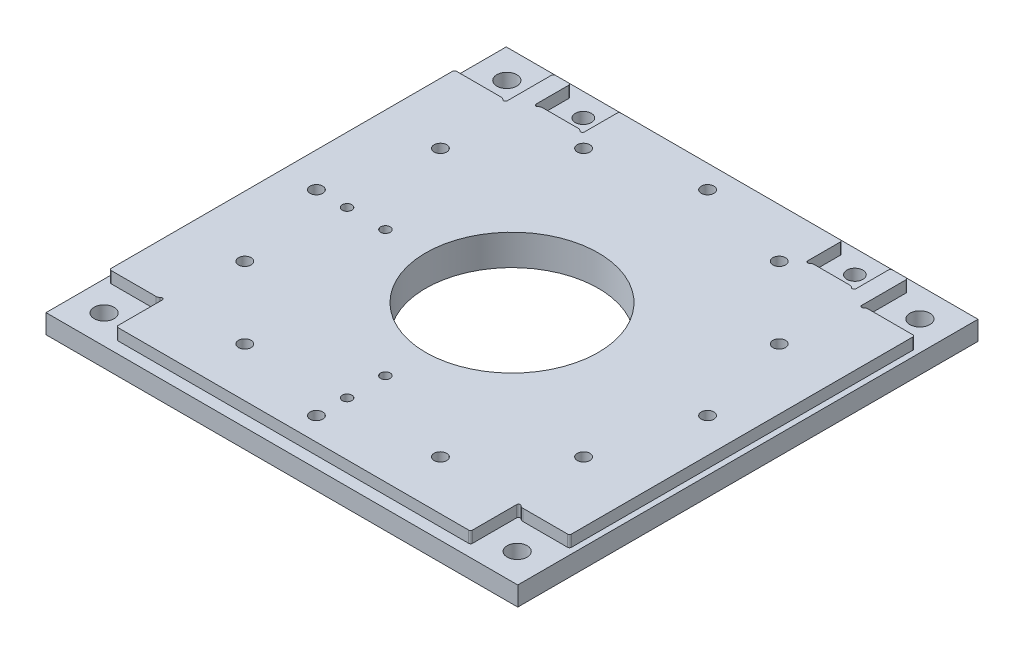
from build123d import *

# Parameters (mm, degrees)
SKETCH_1_W          = 120
SKETCH_1_H          = 120
EXTRUDE_1_DEPTH     = 3
SKETCH_3_W          = 123
SKETCH_3_H          = 120
EXTRUDE_2_DEPTH     = 5
SKETCH_2_R          = 1.65
CUT_EXTRUDE_1_DEPTH = 87.291656607
SKETCH_5_W          = 15.3
SKETCH_5_H          = 15
SKETCH_5_W_2        = 12.6
SKETCH_5_H_2        = 12
CUT_EXTRUDE_2_DEPTH = 3
SKETCH_6_R          = 2.6
SKETCH_6_R_2        = 2.1
CUT_EXTRUDE_3_DEPTH = 87.291656607
SKETCH_7_R          = 5.5
SKETCH_7_R_2        = 4.6
CUT_EXTRUDE_4_DEPTH = 1
SKETCH_8_R          = 22.5
CUT_EXTRUDE_5_DEPTH = 87.291656607
SKETCH_9_R          = 1.25
CUT_EXTRUDE_6_DEPTH = 87.291656607
SKETCH_11_W         = 92.4
SKETCH_11_H         = 3
CUT_EXTRUDE_7_DEPTH = 3
FILLET_1_R          = 0.5
SKETCH_12_R         = 0.5
CUT_EXTRUDE_8_DEPTH = 3
FILLET_2_R          = 1


with BuildPart() as part:
    # 草图1 → 凸台-拉伸1 (new body)
    with BuildSketch(Plane(origin=(0, 0, 0), x_dir=(1, 0, 0), z_dir=(0, 1, 0))):
        Rectangle(SKETCH_1_W, SKETCH_1_H)
    extrude(amount=EXTRUDE_1_DEPTH)

    # 草图3 → 凸台-拉伸2 (add)
    with BuildSketch(Plane.XZ):
        Rectangle(SKETCH_3_W, SKETCH_3_H)
    extrude(amount=EXTRUDE_2_DEPTH)

    # 草图2 → 切除-拉伸1 (cut, through all)
    with BuildSketch(Plane(origin=(0, 3, 0), x_dir=(1, 0, 0), z_dir=(0, 1, 0))):
        with Locations(Location((-51, 0, 0), (0, 0, 270))):
            Circle(SKETCH_2_R)
        with Locations(Location((-44.167295593, -25.5, 0), (0, 0, 270))):
            Circle(SKETCH_2_R)
        with Locations(Location((-25.5, -44.167295593, 0), (0, 0, 270))):
            Circle(SKETCH_2_R)
        with Locations(Location((0, -51, 0), (0, 0, 270))):
            Circle(SKETCH_2_R)
        with Locations(Location((25.5, -44.167295593, 0), (0, 0, 270))):
            Circle(SKETCH_2_R)
        with Locations(Location((44.167295593, -25.5, 0), (0, 0, 270))):
            Circle(SKETCH_2_R)
        with Locations(Location((-25.5, 44.167295593, 0), (0, 0, 270))):
            Circle(SKETCH_2_R)
        with Locations(Location((-44.167295593, 25.5, 0), (0, 0, 270))):
            Circle(SKETCH_2_R)
        with Locations(Location((0, 51, 0), (0, 0, 270))):
            Circle(SKETCH_2_R)
        with Locations(Location((25.5, 44.167295593, 0), (0, 0, 270))):
            Circle(SKETCH_2_R)
        with Locations(Location((44.167295593, 25.5, 0), (0, 0, 270))):
            Circle(SKETCH_2_R)
        with Locations(Location((51, 0, 0), (0, 0, 270))):
            Circle(SKETCH_2_R)
    extrude(amount=-CUT_EXTRUDE_1_DEPTH, mode=Mode.SUBTRACT)

    # 草图5 → 切除-拉伸2 (cut)
    with BuildSketch(Plane(origin=(0, 3, 0), x_dir=(1, 0, 0), z_dir=(0, 1, 0))):
        with Locations((-53.85, 52.5)):
            Rectangle(SKETCH_5_W, SKETCH_5_H)
        with Locations((53.85, 52.5)):
            Rectangle(SKETCH_5_W, SKETCH_5_H)
        with Locations((-35.4, 54)):
            Rectangle(SKETCH_5_W_2, SKETCH_5_H_2)
        with Locations((35.4, 54)):
            Rectangle(SKETCH_5_W_2, SKETCH_5_H_2)
        with Locations((-53.85, -52.5)):
            Rectangle(SKETCH_5_W, SKETCH_5_H)
        with Locations((53.85, -52.5)):
            Rectangle(SKETCH_5_W, SKETCH_5_H)
    extrude(amount=-CUT_EXTRUDE_2_DEPTH, mode=Mode.SUBTRACT)

    # 草图6 → 切除-拉伸3 (cut, through all)
    with BuildSketch(Plane(origin=(0, 3, 0), x_dir=(1, 0, 0), z_dir=(0, 1, 0))):
        with Locations(Location((-53.85, -52.5, 0), (0, 0, 270))):
            Circle(SKETCH_6_R)
        with Locations(Location((53.85, -52.5, 0), (0, 0, 270))):
            Circle(SKETCH_6_R)
        with Locations(Location((-53.85, 52.5, 0), (0, 0, 270))):
            Circle(SKETCH_6_R)
        with Locations(Location((-35.4, 54, 0), (0, 0, 270))):
            Circle(SKETCH_6_R_2)
        with Locations(Location((53.85, 52.5, 0), (0, 0, 270))):
            Circle(SKETCH_6_R)
        with Locations(Location((35.4, 54, 0), (0, 0, 270))):
            Circle(SKETCH_6_R_2)
    extrude(amount=-CUT_EXTRUDE_3_DEPTH, mode=Mode.SUBTRACT)

    # 草图7 → 切除-拉伸4 (cut)
    with BuildSketch(Plane.XZ.offset(5)):
        with Locations(Location((-53.85, 52.5, 0), (0, 0, 270))):
            Circle(SKETCH_7_R)
        with Locations(Location((-53.85, -52.5, 0), (0, 0, 270))):
            Circle(SKETCH_7_R)
        with Locations(Location((-35.4, -54, 0), (0, 0, 270))):
            Circle(SKETCH_7_R_2)
        with Locations(Location((53.85, 52.5, 0), (0, 0, 270))):
            Circle(SKETCH_7_R)
        with Locations(Location((53.85, -52.5, 0), (0, 0, 270))):
            Circle(SKETCH_7_R)
        with Locations(Location((35.4, -54, 0), (0, 0, 270))):
            Circle(SKETCH_7_R_2)
    extrude(amount=-CUT_EXTRUDE_4_DEPTH, mode=Mode.SUBTRACT)

    # 草图8 → 切除-拉伸5 (cut, through all)
    with BuildSketch(Plane(origin=(0, 3, 0), x_dir=(1, 0, 0), z_dir=(0, 1, 0))):
        with Locations(Location((0, 0, 0), (0, 0, 270))):
            Circle(SKETCH_8_R)
    extrude(amount=-CUT_EXTRUDE_5_DEPTH, mode=Mode.SUBTRACT)

    # 草图9 → 切除-拉伸6 (cut, through all)
    with BuildSketch(Plane(origin=(0, 3, 0), x_dir=(1, 0, 0), z_dir=(0, 1, 0))):
        with Locations(Location((0, -43, 0), (0, 0, 270))):
            Circle(SKETCH_9_R)
        with Locations(Location((0, -33, 0), (0, 0, 270))):
            Circle(SKETCH_9_R)
        with Locations(Location((-43, 0, 0), (0, 0, 270))):
            Circle(SKETCH_9_R)
        with Locations(Location((-33, 0, 0), (0, 0, 270))):
            Circle(SKETCH_9_R)
    extrude(amount=-CUT_EXTRUDE_6_DEPTH, mode=Mode.SUBTRACT)

    # 草图11 → 切除-拉伸7 (cut)
    with BuildSketch(Plane(origin=(0, 3, 0), x_dir=(1, 0, 0), z_dir=(0, 1, 0))):
        with Locations((0, -58.5)):
            Rectangle(SKETCH_11_W, SKETCH_11_H)
        with Locations((0, 58.5)):
            Rectangle(SKETCH_11_W, SKETCH_11_H)
    extrude(amount=-CUT_EXTRUDE_7_DEPTH, mode=Mode.SUBTRACT)

    # 圆角1
    fillet_1_edges = [part.edges().sort_by_distance(p)[0] for p in [
        (-60, 1.5, 45),
        (60, 1.5, -45),
        (60, 1.5, 45),
        (-60, 1.5, -45),
        (-46.2, 1.5, 57),
        (46.2, 1.5, 57),
        (-29.1, 1.5, -57),
        (29.1, 1.5, -57),
        (-41.7, 1.5, -57),
        (41.7, 1.5, -57),
        (46.2, 1.5, -57),
        (-46.2, 1.5, -57),
    ]]
    fillet(fillet_1_edges, radius=FILLET_1_R)

    # 草图12 → 切除-拉伸8 (cut)
    with BuildSketch(Plane(origin=(0, 3, 0), x_dir=(1, 0, 0), z_dir=(0, 1, 0))):
        with Locations((-46.7, 45)):
            Circle(SKETCH_12_R)
        with Locations((-41.2, 48)):
            Circle(SKETCH_12_R)
        with Locations((-46.7, -45)):
            Circle(SKETCH_12_R)
        with Locations((41.2, 48)):
            Circle(SKETCH_12_R)
        with Locations((46.7, -45)):
            Circle(SKETCH_12_R)
        with Locations((46.7, 45)):
            Circle(SKETCH_12_R)
        with Locations((-29.6, 48)):
            Circle(SKETCH_12_R)
        with Locations((29.6, 48)):
            Circle(SKETCH_12_R)
    extrude(amount=-CUT_EXTRUDE_8_DEPTH, mode=Mode.SUBTRACT)

    # 圆角2
    fillet_2_edges = [part.edges().sort_by_distance(p)[0] for p in [
        (40.7, 1.5, -48),
        (-30.1, 1.5, -48),
        (-47.2, 1.5, 45),
        (-40.7, 1.5, -48),
        (47.2, 1.5, -45),
        (30.1, 1.5, -48),
        (47.2, 1.5, 45),
        (-47.2, 1.5, -45),
    ]]
    fillet(fillet_2_edges, radius=FILLET_2_R)


solid = part.part
